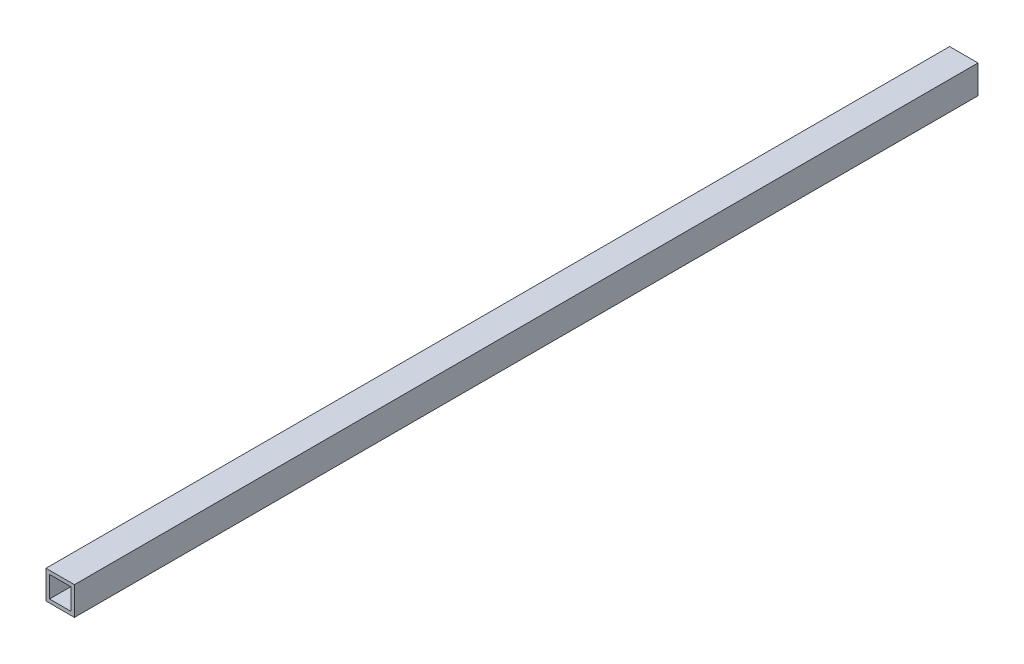
from build123d import *

# Parameters (mm, degrees)
BOSS_EXTRUDE1_DEPTH      = 403.86
BOSS_EXTRUDE1_DEPTH_BACK = 403.86
SKETCH3_W                = 25.4
SKETCH3_H                = 25.4
SKETCH3_W_2              = 19.05
SKETCH3_H_2              = 19.05


with BuildPart() as part:
    # Sketch3 → Boss-Extrude1 (new, two sides: drawn at the far end of the back side and taken through both)
    with BuildSketch(Plane.XY.offset(-BOSS_EXTRUDE1_DEPTH_BACK)):
        Rectangle(SKETCH3_W, SKETCH3_H)
        Rectangle(SKETCH3_W_2, SKETCH3_H_2, mode=Mode.SUBTRACT)
    extrude(amount=BOSS_EXTRUDE1_DEPTH + BOSS_EXTRUDE1_DEPTH_BACK)


solid = part.part
